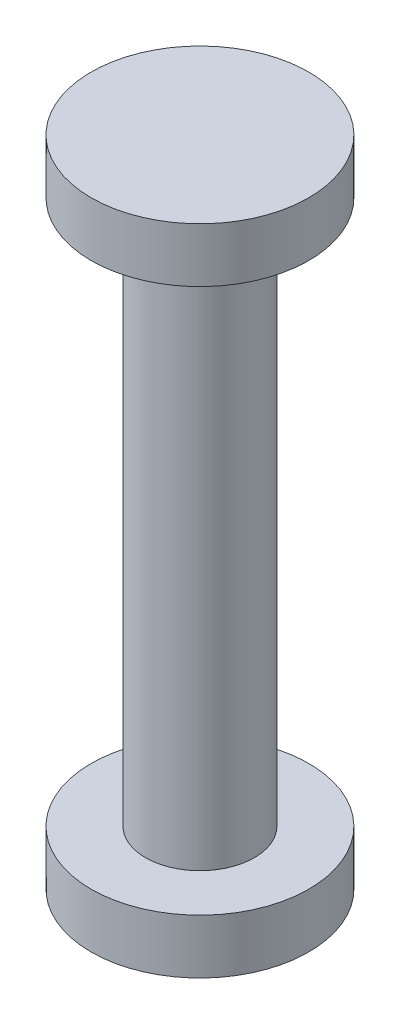
from build123d import *

# Parameters (mm, degrees)
SKETCH1_R           = 5
BOSS_EXTRUDE1_DEPTH = 25
SKETCH2_R           = 10
BOSS_EXTRUDE2_DEPTH = 5


with BuildPart() as part:
    # Sketch1 → Boss-Extrude1 (new, symmetric)
    with BuildSketch(Plane(origin=(0, 0, 0), x_dir=(1, 0, 0), z_dir=(0, 1, 0))):
        with Locations(Location((0, 0, 0), (0, 0, 270))):
            Circle(SKETCH1_R)
    extrude(amount=BOSS_EXTRUDE1_DEPTH, both=True)

    # Sketch2 → Boss-Extrude2 (add)
    with BuildSketch(Plane(origin=(0, 25, 0), x_dir=(1, 0, 0), z_dir=(0, 1, 0))):
        with Locations(Location((0, 0, 0), (0, 0, 270))):
            Circle(SKETCH2_R)
    boss_extrude2 = extrude(amount=BOSS_EXTRUDE2_DEPTH)

    # Mirror1: Boss-Extrude2 across plane
    add(boss_extrude2.mirror(Plane.ZX))


solid = part.part
